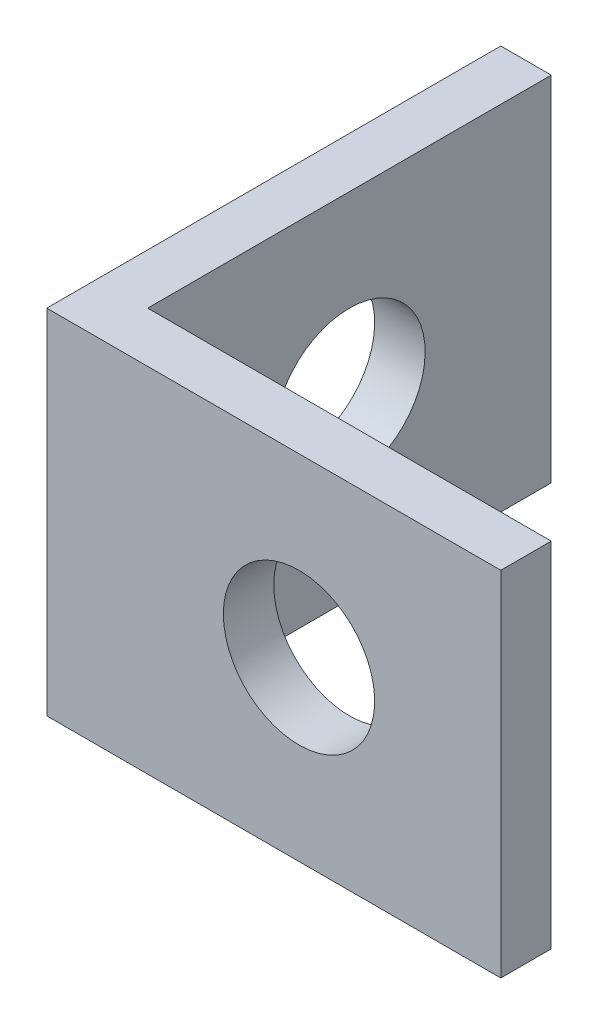
from build123d import *

# Parameters (mm, degrees)
ESQUISSE1_W             = 8
ESQUISSE1_H             = 7
BOSS_EXTRU_1_DEPTH      = 1
ESQUISSE2_W             = 1
ESQUISSE2_H             = 7
BOSS_EXTRU_2_DEPTH      = 9
ESQUISSE3_R             = 1.5
ENL_V_MAT_EXTRU_1_DEPTH = 14.304134696
ESQUISSE4_R             = 1.5
ENL_V_MAT_EXTRU_2_DEPTH = 12.747340124


with BuildPart() as part:
    # Esquisse1 → Boss.-Extru.1 (new body)
    with BuildSketch(Plane.XY):
        with Locations((0, 3.5)):
            Rectangle(ESQUISSE1_W, ESQUISSE1_H)
    extrude(amount=BOSS_EXTRU_1_DEPTH)

    # Esquisse2 → Boss.-Extru.2 (add)
    with BuildSketch(Plane.XY.offset(1)):
        with Locations((-4.5, 3.5)):
            Rectangle(ESQUISSE2_W, ESQUISSE2_H)
    extrude(amount=-BOSS_EXTRU_2_DEPTH)

    # Esquisse3 → Enlèv. mat.-Extru.1 (cut, through all)
    with BuildSketch(Plane(origin=(-4, 0, 0), x_dir=(0, 0, -1), z_dir=(1, 0, 0))):
        with Locations(Location((4, 3.5, 0), (0, 0, 90))):
            Circle(ESQUISSE3_R)
    extrude(amount=-ENL_V_MAT_EXTRU_1_DEPTH, mode=Mode.SUBTRACT)

    # Esquisse4 → Enlèv. mat.-Extru.2 (cut, through all)
    with BuildSketch(Plane(origin=(0, 0, 0), x_dir=(-1, 0, 0), z_dir=(0, 0, -1))):
        with Locations((0, 3.5)):
            Circle(ESQUISSE4_R)
    extrude(amount=-ENL_V_MAT_EXTRU_2_DEPTH, mode=Mode.SUBTRACT)


solid = part.part
